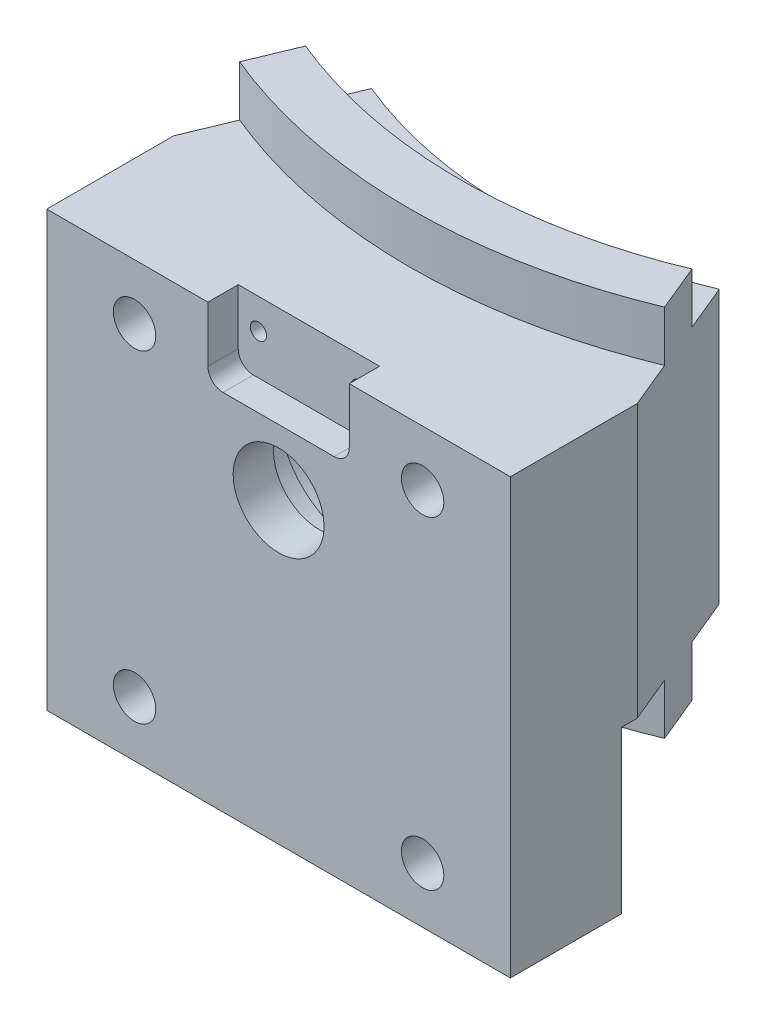
from build123d import *

# Parameters (mm, degrees)
BOSS_EXTRUDE1_DEPTH      = 13.5
BOSS_EXTRUDE2_DEPTH      = 18.5
BOSS_EXTRUDE3_DEPTH      = 5
SKETCH4_W                = 45.922011884
SKETCH4_H                = 20
BOSS_EXTRUDE4_DEPTH      = 13.5
SKETCH2_R                = 4
CUT_EXTRUDE1_DEPTH       = 268.629329099
SKETCH5_R                = 8
CUT_EXTRUDE2_DEPTH       = 4
SKETCH6_R                = 9
CUT_EXTRUDE3_DEPTH       = 12
SKETCH7_R                = 12.5
CUT_EXTRUDE4_DEPTH       = 5
BOSS_EXTRUDE5_DEPTH      = 13.5
CUT_EXTRUDE5_REACH       = 210.1
SKETCH8_R                = 9
CUT_EXTRUDE6_REACH       = 210.1
SKETCH10_R               = 4.5
SKETCH18_R               = 11
CUT_EXTRUDE9_DEPTH       = 47
CUT_EXTRUDE10_DEPTH      = 268.629329099
CUT_EXTRUDE10_DEPTH_BACK = 268.629329099
SKETCH19_W               = 45.922011884
SKETCH19_H               = 198
SKETCH30_R               = 8.025
CUT_EXTRUDE13_DEPTH      = 4
BOSS_EXTRUDE9_DEPTH      = 16
M5_TAPPED_HOLE2_D        = 4.2
CUT_EXTRUDE17_DEPTH      = 3
M2_TAPPED_HOLE1_D        = 1.6
M2_TAPPED_HOLE1_DEPTH    = 8
M2_TAPPED_HOLE1_TIP      = 0.480688495


with BuildPart() as part:
    # Sketch1 → Boss-Extrude1 (new, symmetric)
    with BuildSketch(Plane(origin=(0, 0, 0), x_dir=(1, 0, 0), z_dir=(0, 1, 0))):
        with BuildLine():
            ThreePointArc((17.220754456, -41.574578963), (0, -45), (-17.220754456, -41.574578963))
            Line((-17.220754456, -41.574578963), (-22.961005942, -55.432771951))
            ThreePointArc((-22.961005942, -55.432771951), (0, -60), (22.961005942, -55.432771951))
            Line((22.961005942, -55.432771951), (17.220754456, -41.574578963))
        make_face()
    extrude(amount=BOSS_EXTRUDE1_DEPTH, both=True)

    # Sketch1<3> → Boss-Extrude2 (add, symmetric)
    with BuildSketch(Plane(origin=(0, 0, 0), x_dir=(1, 0, 0), z_dir=(0, 1, 0))):
        with BuildLine():
            ThreePointArc((19.134171618, -46.193976626), (0, -50), (-19.134171618, -46.193976626))
            Line((-19.134171618, -46.193976626), (-21.04758878, -50.813374288))
            ThreePointArc((-21.04758878, -50.813374288), (0, -55), (21.04758878, -50.813374288))
            Line((21.04758878, -50.813374288), (19.134171618, -46.193976626))
        make_face()
    extrude(amount=BOSS_EXTRUDE2_DEPTH, both=True)

    # Sketch3 → Boss-Extrude3 (add, symmetric)
    with BuildSketch(Plane.XZ):
        with BuildLine():
            Line((-22.961005942, 266), (-22.961005942, 55.432771951))
            ThreePointArc((-22.961005942, 55.432771951), (-20.481139434, 56.39612511), (-17.961005942, 57.248600555))
            Line((-17.961005942, 57.248600555), (-17.961005942, 246))
            Line((-17.961005942, 246), (17.961005942, 246))
            Line((17.961005942, 246), (17.961005942, 57.248600555))
            ThreePointArc((17.961005942, 57.248600555), (20.481139434, 56.39612511), (22.961005942, 55.432771951))
            Line((22.961005942, 55.432771951), (22.961005942, 266))
            Line((22.961005942, 266), (-22.961005942, 266))
        make_face()
    extrude(amount=BOSS_EXTRUDE3_DEPTH, both=True)

    # Sketch4 → Boss-Extrude4 (add, symmetric)
    with BuildSketch(Plane(origin=(0, 0, 0), x_dir=(1, 0, 0), z_dir=(0, 1, 0))):
        with Locations((0, -256)):
            Rectangle(SKETCH4_W, SKETCH4_H)
    extrude(amount=BOSS_EXTRUDE4_DEPTH, both=True)

    # Sketch2 → Cut-Extrude1 (cut, through all)
    with BuildSketch(Plane.XY):
        Circle(SKETCH2_R)
    extrude(amount=CUT_EXTRUDE1_DEPTH, mode=Mode.SUBTRACT)

    # Sketch5 → Cut-Extrude2 (cut)
    with BuildSketch(Plane(origin=(0, 0, 246), x_dir=(-1, 0, 0), z_dir=(0, 0, -1))):
        Circle(SKETCH5_R)
    extrude(amount=-CUT_EXTRUDE2_DEPTH, mode=Mode.SUBTRACT)

    # Sketch6 → Cut-Extrude3 (cut)
    with BuildSketch(Plane.XY.offset(266)):
        Circle(SKETCH6_R)
    extrude(amount=-CUT_EXTRUDE3_DEPTH, mode=Mode.SUBTRACT)

    # Sketch7 → Cut-Extrude4 (cut)
    with BuildSketch(Plane.XY.offset(266)):
        Circle(SKETCH7_R)
    extrude(amount=-CUT_EXTRUDE4_DEPTH, mode=Mode.SUBTRACT)

    # Sketch9 → Boss-Extrude5 (add, symmetric)
    with BuildSketch(Plane(origin=(0, 0, 0), x_dir=(1, 0, 0), z_dir=(0, 1, 0))):
        with BuildLine():
            Line((-22.961005942, -55.432771951), (-22.961005942, -68))
            Line((-22.961005942, -68), (22.961005942, -68))
            Line((22.961005942, -68), (22.961005942, -55.432771951))
            ThreePointArc((22.961005942, -55.432771951), (0, -60), (-22.961005942, -55.432771951))
        make_face()
    extrude(amount=BOSS_EXTRUDE5_DEPTH, both=True)

    # Sketch8 → Cut-Extrude5 (cut, up to next)
    with BuildSketch(Plane.XY.offset(60), mode=Mode.PRIVATE) as cut_extrude5_sk1:
        Circle(SKETCH8_R)
    cut_extrude5_tool1 = extrude(cut_extrude5_sk1.sketch, amount=-CUT_EXTRUDE5_REACH, mode=Mode.PRIVATE) & part.part
    add(cut_extrude5_tool1.solids().sort_by_distance((0, 0, 60))[0], mode=Mode.SUBTRACT)

    # Sketch10 → Cut-Extrude6 (cut, up to next)
    with BuildSketch(Plane.XY.offset(60), mode=Mode.PRIVATE) as cut_extrude6_sk1:
        Circle(SKETCH10_R)
    cut_extrude6_tool1 = extrude(cut_extrude6_sk1.sketch, amount=CUT_EXTRUDE6_REACH, mode=Mode.PRIVATE) & part.part
    add(cut_extrude6_tool1.solids().sort_by_distance((0, 0, 60))[0], mode=Mode.SUBTRACT)

    # Sketch18 → Cut-Extrude9 (cut)
    with BuildSketch(Plane.XY):
        Circle(SKETCH18_R)
    extrude(amount=CUT_EXTRUDE9_DEPTH, mode=Mode.SUBTRACT)

    # Sketch19 → Cut-Extrude10 (cut, two sides: drawn at the far end of the back side and taken through both)
    with BuildSketch(Plane(origin=(0, 0, 0), x_dir=(1, 0, 0), z_dir=(0, 1, 0)).offset(-CUT_EXTRUDE10_DEPTH_BACK)):
        with Locations((0, -167)):
            Rectangle(SKETCH19_W, SKETCH19_H)
    extrude(amount=CUT_EXTRUDE10_DEPTH + CUT_EXTRUDE10_DEPTH_BACK, mode=Mode.SUBTRACT)

    # Sketch23 → M5 Tapped Hole1 (revolve, cut)
    with BuildSketch(Plane(origin=(14.26606865, 8, 68), x_dir=(0, -1, 0), z_dir=(1, 0, 0))):
        Polygon((0, 0), (0, 11.3618073), (2.1, 10.1), (2.1, 0), align=None)
    m5_tapped_hole1 = revolve(axis=Axis((14.26606865, 8, 74.35), (0, 0, -1)), mode=Mode.SUBTRACT)

    # Mirror1: M5 Tapped Hole1 across plane
    add(m5_tapped_hole1.mirror(Plane(origin=(0, 0, 0), x_dir=(0, 0, 1), z_dir=(1, 0, 0))), mode=Mode.SUBTRACT)

    # Sketch30 → Cut-Extrude13 (cut)
    with BuildSketch(Plane(origin=(0, 0, 60), x_dir=(-1, 0, 0), z_dir=(0, 0, -1))):
        Circle(SKETCH30_R)
    extrude(amount=-CUT_EXTRUDE13_DEPTH, mode=Mode.SUBTRACT)

    # Sketch37 → Boss-Extrude9 (add)
    with BuildSketch(Plane.XZ.offset(13.5)):
        with BuildLine():
            Line((-22.961005942, 68), (22.961005942, 68))
            Line((22.961005942, 68), (22.961005942, 57))
            ThreePointArc((22.961005942, 57), (0, 61.450856738), (-22.961005942, 57))
            Line((-22.961005942, 57), (-22.961005942, 68))
        make_face()
    extrude(amount=BOSS_EXTRUDE9_DEPTH)

    # M5 Tapped Hole2 (through all)
    with Locations(Plane.XY.offset(68)):
        with Locations((-14.26606865, -24), (14.26606865, -24)):
            Hole(M5_TAPPED_HOLE2_D / 2)

    # Sketch40 → Cut-Extrude17 (cut)
    with BuildSketch(Plane.XY.offset(68)):
        with BuildLine():
            Line((-7, 13.5), (-7, 8))
            ThreePointArc((-7, 8), (-6.560660172, 6.939339828), (-5.5, 6.5))
            Line((-5.5, 6.5), (5.5, 6.5))
            ThreePointArc((5.5, 6.5), (6.560660172, 6.939339828), (7, 8))
            Line((7, 8), (7, 13.5))
            Line((7, 13.5), (-7, 13.5))
        make_face()
    extrude(amount=-CUT_EXTRUDE17_DEPTH, mode=Mode.SUBTRACT)

    # M2 Tapped Hole1
    with Locations(Plane.XY.offset(65)):
        with Locations((5, 10.5), (-5, 10.5)):
            Hole(M2_TAPPED_HOLE1_D / 2, depth=M2_TAPPED_HOLE1_DEPTH)
            with Locations((0, 0, -(M2_TAPPED_HOLE1_DEPTH + M2_TAPPED_HOLE1_TIP / 2))):  # 118° drill point
                Cone(0, M2_TAPPED_HOLE1_D / 2, M2_TAPPED_HOLE1_TIP, mode=Mode.SUBTRACT)


solid = part.part
